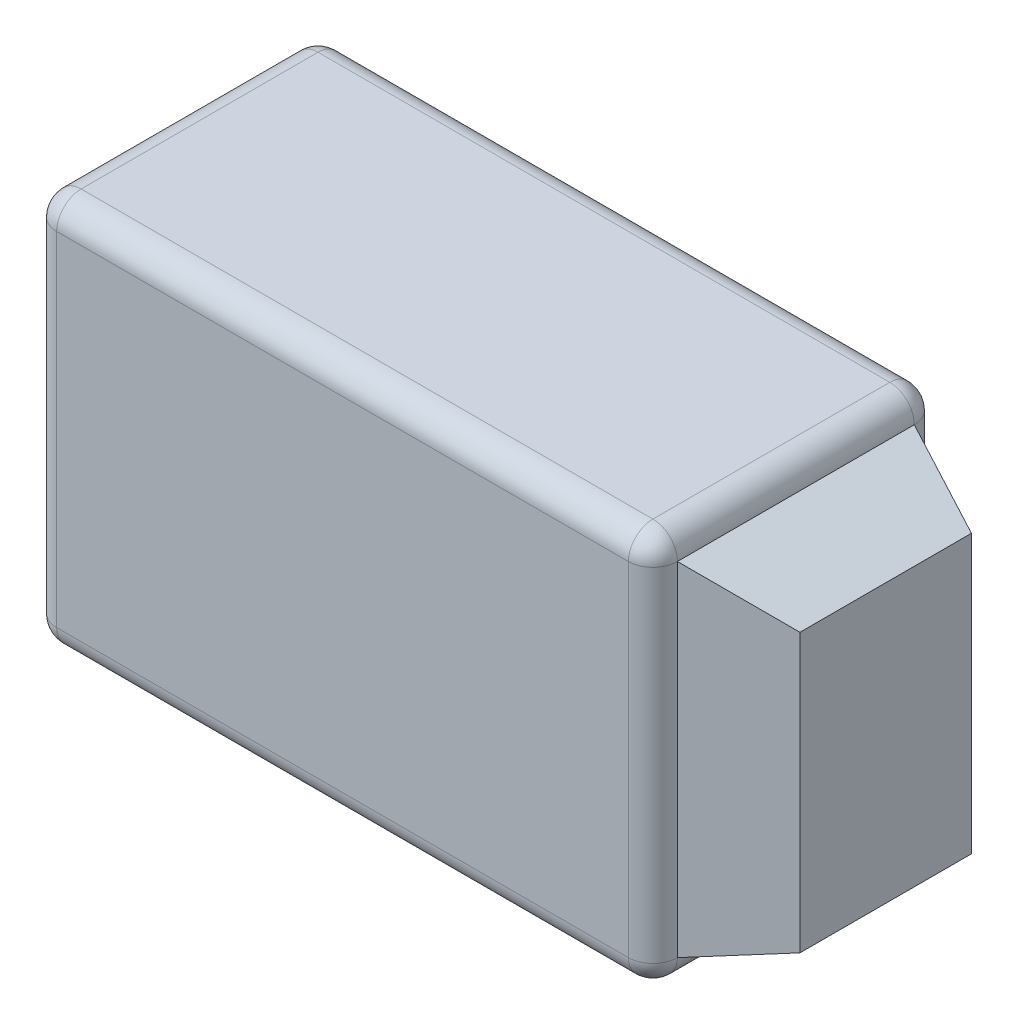
from build123d import *

# Parameters (mm, degrees)
ESBO_O1_W                = 76
ESBO_O1_H                = 35
RESSALTO_EXTRUS_O1_DEPTH = 48
FILETE1_R                = 3
ESBO_O11_W               = 29
ESBO_O11_H               = 42
RESSALTO_EXTRUS_O2_DEPTH = 11
RESSALTO_EXTRUS_O2_TAPER = 20


with BuildPart() as part:
    # Esboço1 → Ressalto-extrusão1 (new body)
    with BuildSketch(Plane(origin=(0, 0, 0), x_dir=(1, 0, 0), z_dir=(0, 1, 0))):
        Rectangle(ESBO_O1_W, ESBO_O1_H)
    extrude(amount=RESSALTO_EXTRUS_O1_DEPTH)

    # Filete1
    filete1_edges = [part.edges().sort_by_distance(p)[0] for p in [
        (38, 48, 0),
        (0, 48, -17.5),
        (-38, 48, 0),
        (0, 0, -17.5),
        (38, 0, 0),
        (0, 0, 17.5),
        (-38, 0, 0),
        (-38, 24, -17.5),
        (38, 24, -17.5),
        (38, 24, 17.5),
        (-38, 24, 17.5),
        (0, 48, 17.5),
    ]]
    fillet(filete1_edges, radius=FILETE1_R)

    # Esboço11 → Ressalto-extrusão2 (add)
    with BuildSketch(Plane(origin=(38, 0, 0), x_dir=(0, 0, -1), z_dir=(1, 0, 0))):
        with Locations((0, 24)):
            Rectangle(ESBO_O11_W, ESBO_O11_H)
    extrude(amount=RESSALTO_EXTRUS_O2_DEPTH, taper=RESSALTO_EXTRUS_O2_TAPER)


solid = part.part
